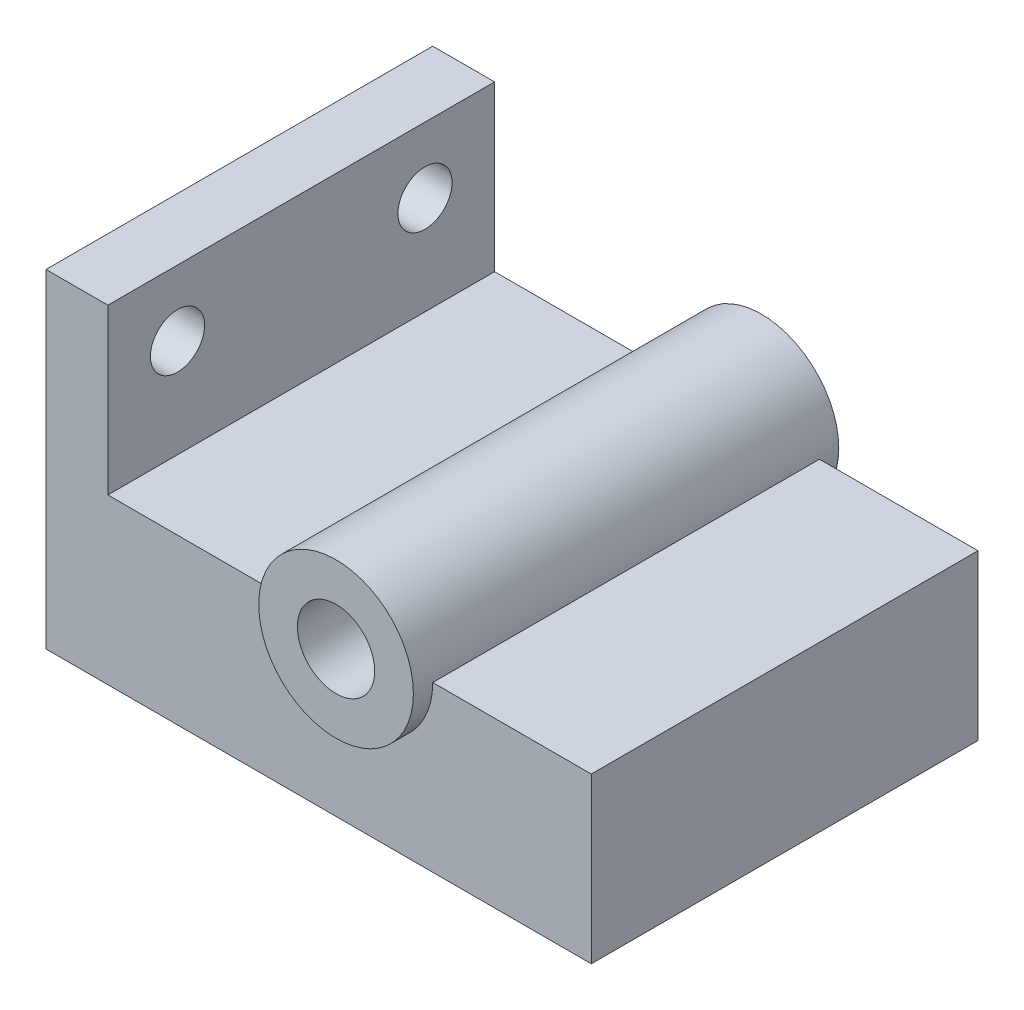
from build123d import *

# Parameters (mm, degrees)
BOSS_EXTRUDE1_DEPTH      = 1270
BOSS_EXTRUDE1_DEPTH_BACK = 1270
BOSS_EXTRUDE2_DEPTH      = 1397
BOSS_EXTRUDE2_DEPTH_BACK = 1397
SKETCH1_3_R              = 254
SKETCH2_W                = 1524
SKETCH2_H                = 635
CUT_EXTRUDE1_DEPTH       = 3175
SKETCH3_R                = 177.8
CUT_EXTRUDE2_DEPTH       = 508
SCALE1_SCALE             = 0.0393701


with BuildPart() as part:
    # Sketch1 → Boss-Extrude1 (new, two sides: drawn at the far end of the back side and taken through both)
    with BuildSketch(Plane.XY.offset(-BOSS_EXTRUDE1_DEPTH_BACK)):
        with BuildLine():
            Line((0, 2159), (0, 0))
            Line((0, 0), (3581.4, 0))
            Line((3581.4, 0), (3581.4, 1079.5))
            Line((3581.4, 1079.5), (2540, 1079.5))
            ThreePointArc((2540, 1079.5), (2032, 571.5), (1524, 1079.5))
            Line((1524, 1079.5), (406.4, 1079.5))
            Line((406.4, 1079.5), (406.4, 2159))
            Line((406.4, 2159), (0, 2159))
        make_face()
    extrude(amount=BOSS_EXTRUDE1_DEPTH + BOSS_EXTRUDE1_DEPTH_BACK)

    # Sketch1<3> → Boss-Extrude2 (add, two sides: drawn at the far end of the back side and taken through both)
    with BuildSketch(Plane.XY.offset(-BOSS_EXTRUDE2_DEPTH_BACK)):
        with BuildLine():
            ThreePointArc((1524, 1079.5), (2032, 571.5), (2540, 1079.5))
            ThreePointArc((2540, 1079.5), (2032, 1587.5), (1524, 1079.5))
        make_face()
        with Locations((2032, 1079.5)):
            Circle(SKETCH1_3_R, mode=Mode.SUBTRACT)
    extrude(amount=BOSS_EXTRUDE2_DEPTH + BOSS_EXTRUDE2_DEPTH_BACK)

    # Sketch2 → Cut-Extrude1 (cut)
    with BuildSketch(Plane.ZY):
        with Locations((0, 317.5)):
            Rectangle(SKETCH2_W, SKETCH2_H)
    extrude(amount=-CUT_EXTRUDE1_DEPTH, mode=Mode.SUBTRACT)

    # Sketch3 → Cut-Extrude2 (cut)
    with BuildSketch(Plane.ZY):
        with Locations((-812.8, 1727.2)):
            Circle(SKETCH3_R)
        with Locations((812.8, 1727.2)):
            Circle(SKETCH3_R)
    extrude(amount=-CUT_EXTRUDE2_DEPTH, mode=Mode.SUBTRACT)


with BuildPart() as part_1:
    # Scale1: scaled about (1689.519743013, 820.589305636, 0)
    add(part.part.scale(SCALE1_SCALE).moved(Location((1623.003181779, 788.282622614, 0))))


solid = part_1.part
